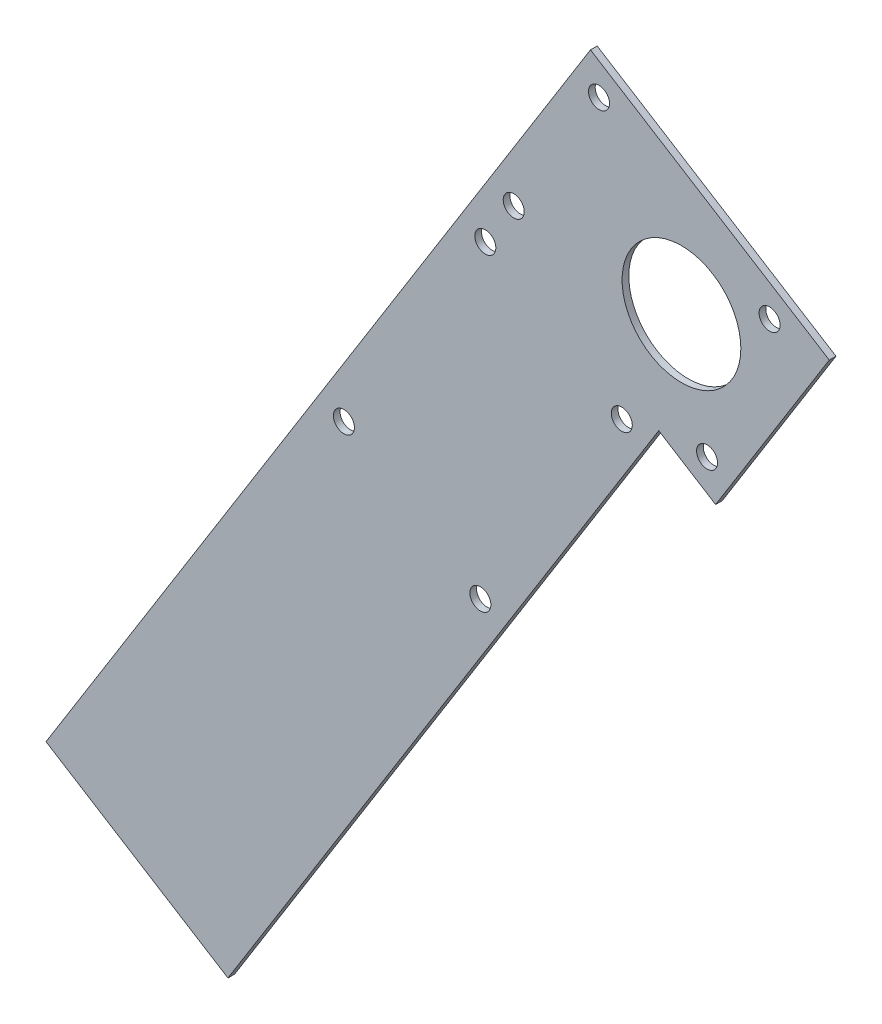
from build123d import *

# Parameters (mm, degrees)
BOSS_EXTRUDE1_DEPTH    = 1.5875
F_10_CLEARANCE_HOLE1_D = 4.9784
SKETCH5_R              = 14.057169334
CUT_EXTRUDE1_DEPTH     = 2.54


with BuildPart() as part:
    # Sketch2 → Boss-Extrude1 (new body)
    with BuildSketch(Plane(origin=(0, 0, 321.437), x_dir=(-1, 0, 0), z_dir=(0, 0, -1))):
        Polygon((-54.523488728, -26.582274205), (-27.603590105, -69.663117489), (-14.140826579, -61.25064917), (87.851311222, -224.472188982), (130.932154506, -197.552290359), (2.020118083, 8.750092738), align=None)
    extrude(amount=BOSS_EXTRUDE1_DEPTH)

    # #10 Clearance Hole1 (through all)
    with Locations(Plane(origin=(0, 0, 319.8495), x_dir=(-1, 0, 0), z_dir=(0, 0, -1))):
        with Locations((-5.39073384, -63.270767252), (-25.583472022, -60.913024751), (-40.388290579, -25.237404959), (0, 0), (20.189923968, -32.310632464), (26.919898623, -43.080843285), (60.403864787, -96.666390506), (28.093232323, -116.856314473)):
            Hole(F_10_CLEARANCE_HOLE1_D / 2)

    # Sketch5 → Cut-Extrude1 (cut)
    with BuildSketch(Plane.XY.offset(321.437)):
        with Locations((19.523118205, -34.662746805)):
            Circle(SKETCH5_R)
    extrude(amount=-CUT_EXTRUDE1_DEPTH, mode=Mode.SUBTRACT)


solid = part.part
